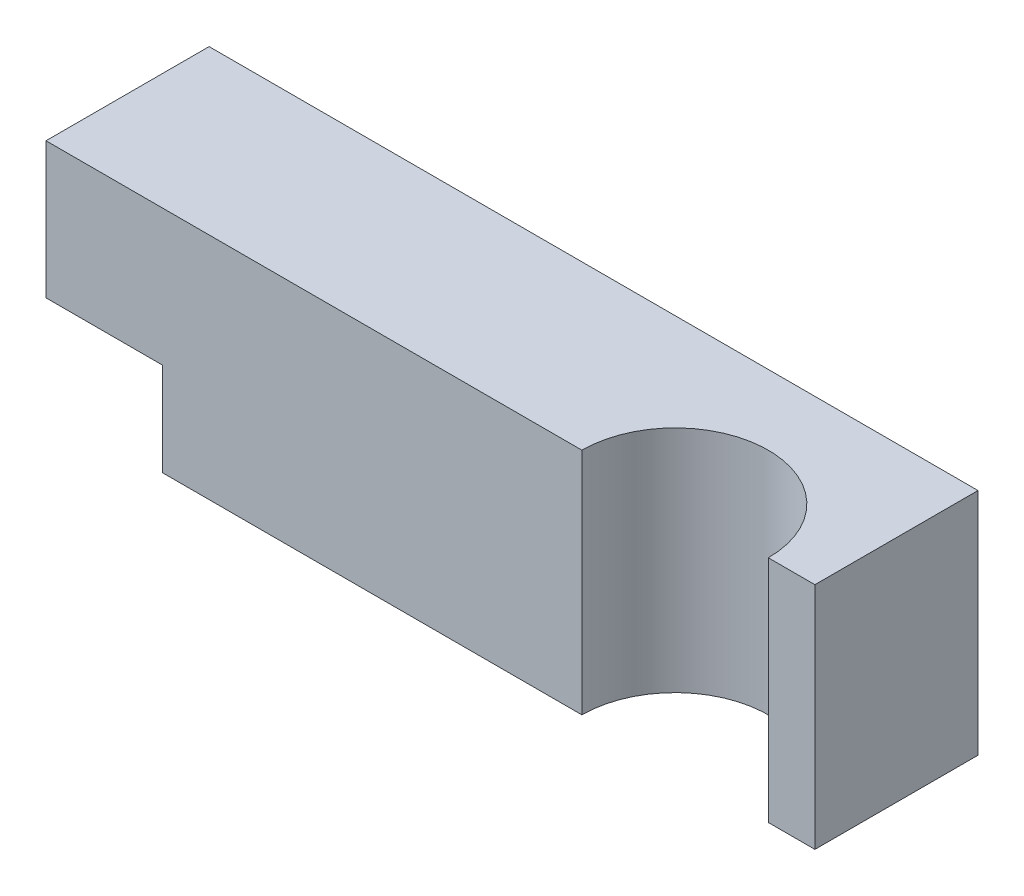
from build123d import *

# Parameters (mm, degrees)
BOSS_EXTRUDE2_DEPTH = 3.5
CUT_EXTRUDE1_DEPTH  = 6


with BuildPart() as part:
    # Sketch4 → Boss-Extrude2 (new body)
    with BuildSketch(Plane.XY):
        Polygon((30.881516436, 14.964687786), (16.881516436, 14.964687786), (16.881516436, 16.964687786), (14.381516436, 16.964687786), (14.381516436, 19.884687786), (20.702643433, 19.884687786), (30.881516436, 19.884687786), (30.881516436, 16.964687786), align=None)
    extrude(amount=BOSS_EXTRUDE2_DEPTH)

    # Sketch5 → Cut-Extrude1 (cut)
    with BuildSketch(Plane(origin=(0, 19.884687786, 0), x_dir=(1, 0, 0), z_dir=(0, 1, 0))):
        with BuildLine():
            Line((27.881516436, -3.5), (29.881516436, -3.5))
            ThreePointArc((29.881516436, -3.5), (27.881516436, -1.5), (25.881516436, -3.5))
            Line((25.881516436, -3.5), (27.881516436, -3.5))
        make_face()
    extrude(amount=-CUT_EXTRUDE1_DEPTH, mode=Mode.SUBTRACT)


solid = part.part
